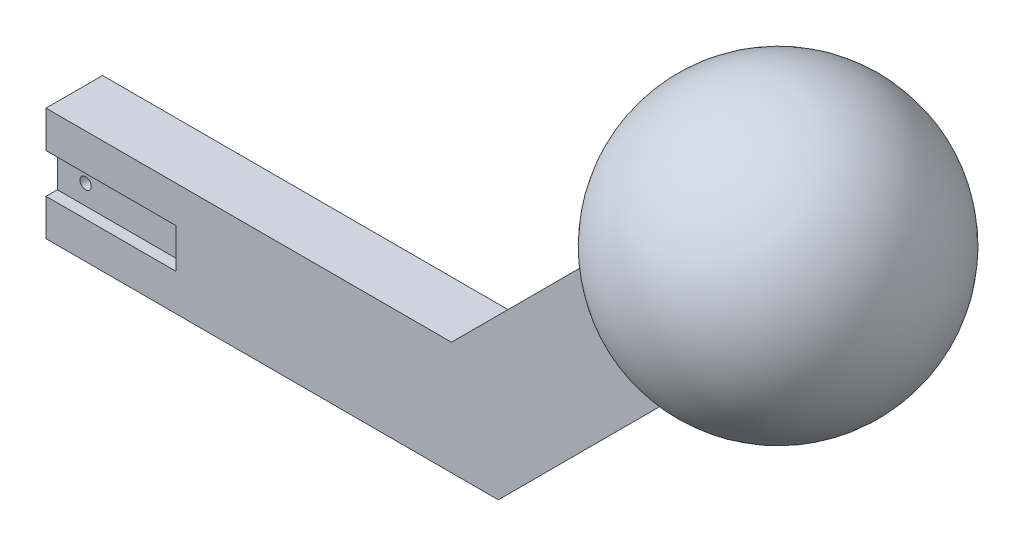
from build123d import *

# Parameters (mm, degrees)
SKETCH1_R           = 1
BOSS_EXTRUDE1_DEPTH = 10
SKETCH5_W           = 23
SKETCH5_H           = 7
CUT_EXTRUDE3_DEPTH  = 2


with BuildPart() as part:
    # Sketch1 → Boss-Extrude1 (new body)
    with BuildSketch(Plane.XY):
        Polygon((0, 0), (80, 0), (115.355339059, 35.355339059), (101.213203436, 49.497474683), (71.715728753, 20), (0, 20), align=None)
        with Locations((5, 10)):
            Circle(SKETCH1_R, mode=Mode.SUBTRACT)
    extrude(amount=BOSS_EXTRUDE1_DEPTH)

    # Sketch2 → Revolve2 (revolve)
    with BuildSketch(Plane.XY.offset(5)):
        with BuildLine():
            Line((108.284271247, 42.426406871), (142.163792523, 76.305928147))
            ThreePointArc((142.163792523, 76.305928147), (145.402623657, 44.93519468), (115.355339059, 35.355339059))
            Line((115.355339059, 35.355339059), (108.284271247, 42.426406871))
        make_face()
    revolve(axis=Axis((108.284271247, 42.426406871, 5), (0.7071067811865457, 0.7071067811865495, 0)))

    # Sketch5 → Cut-Extrude3 (cut)
    with BuildSketch(Plane.XY.offset(10)):
        with Locations((11.5, 10)):
            Rectangle(SKETCH5_W, SKETCH5_H)
    extrude(amount=-CUT_EXTRUDE3_DEPTH, mode=Mode.SUBTRACT)


solid = part.part
